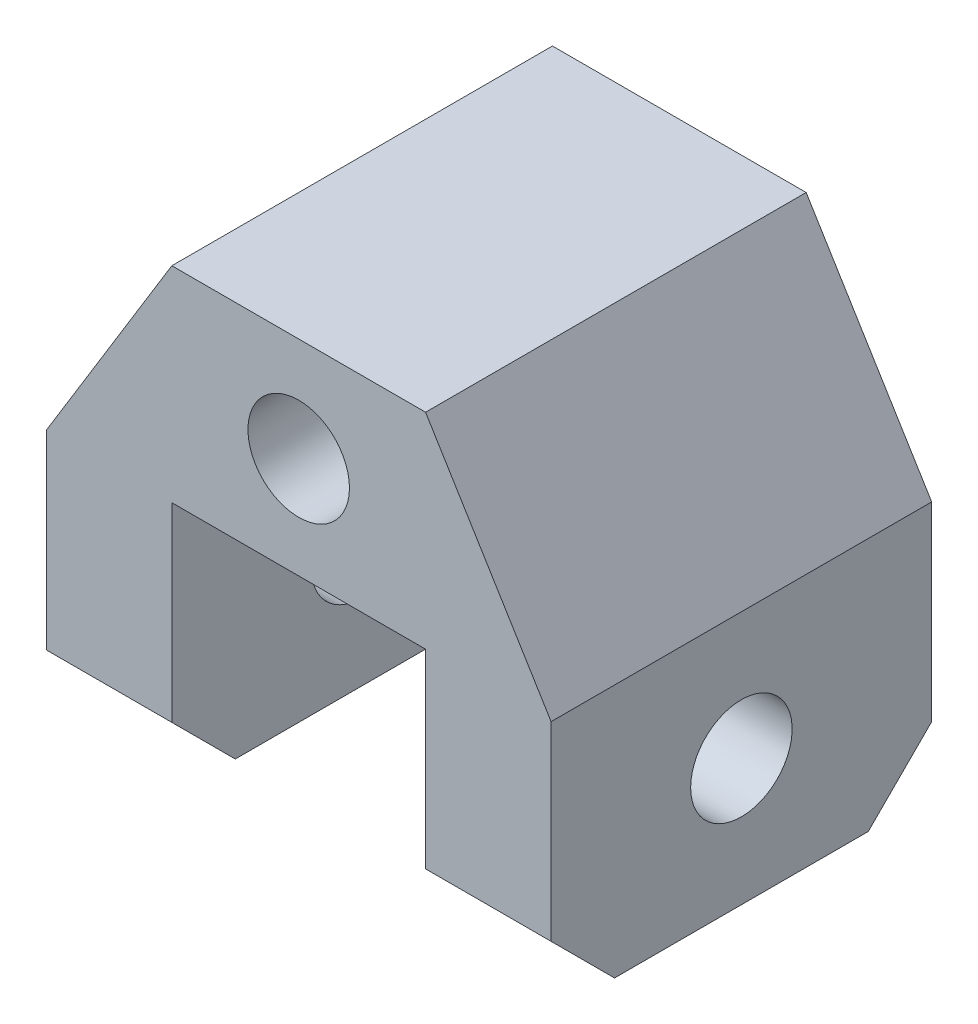
from build123d import *

# Parameters (mm, degrees)
EXTRUDE_1_DEPTH     = 30
CHAMFER_1_SIZE      = 5
SKETCH_2_R          = 4
CUT_EXTRUDE_2_DEPTH = 58.295890515
SKETCH_3_R          = 4
CUT_EXTRUDE_3_DEPTH = 61.952262634


with BuildPart() as part:
    # Эскиз1 → Вытянуть1 (new body)
    with BuildSketch(Plane.XY):
        Polygon((15, 7.896395833), (35, 7.896395833), (44.894389845, -8.278473804), (44.894389845, -28.278473804), (35, -28.278473804), (35, -8.278473804), (15, -8.278473804), (15, -28.278473804), (5.105610155, -28.278473804), (5.105610155, -8.278473804), align=None)
    extrude(amount=EXTRUDE_1_DEPTH)

    # Фаска1
    chamfer_1_edges = [part.edges().sort_by_distance(p)[0] for p in [
        (10.052805078, -28.278473804, 0),
        (39.947194922, -28.278473804, 0),
        (10.052805078, -28.278473804, 30),
        (39.947194922, -28.278473804, 30),
    ]]
    chamfer(chamfer_1_edges, length=CHAMFER_1_SIZE)

    # Эскиз2 → Вытянуть2 (cut, through all)
    with BuildSketch(Plane.ZY.offset(-5.105610155)):
        with Locations((15, -18.278473804)):
            Circle(SKETCH_2_R)
    extrude(amount=-CUT_EXTRUDE_2_DEPTH, mode=Mode.SUBTRACT)

    # Эскиз3 → Вытянуть3 (cut, through all)
    with BuildSketch(Plane.XY.offset(30)):
        with Locations((25, -0.278473804)):
            Circle(SKETCH_3_R)
    extrude(amount=-CUT_EXTRUDE_3_DEPTH, mode=Mode.SUBTRACT)


solid = part.part
